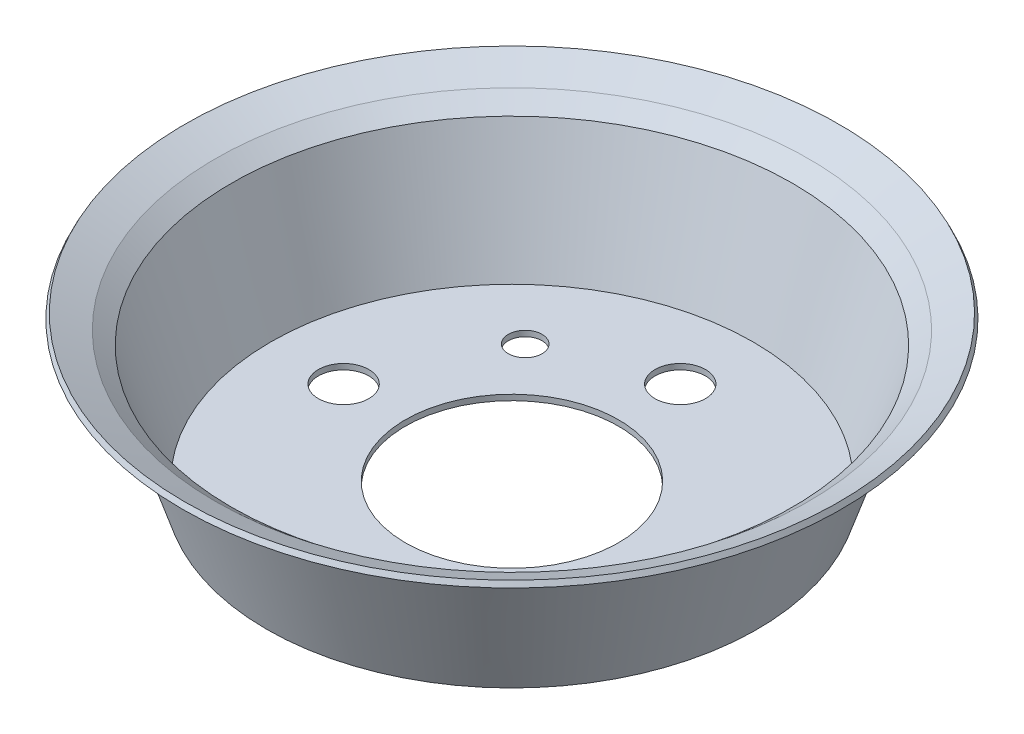
from build123d import *

# Parameters (mm, degrees)
SKETCH_2_R          = 4.5
CUT_EXTRUDE_1_DEPTH = 40
SKETCH_3_R          = 3
CUT_EXTRUDE_2_DEPTH = 5


with BuildPart() as part:
    # Эскиз1 → Повернуть-Тонкостенный1 (revolve)
    with BuildSketch(Plane.XY, mode=Mode.PRIVATE) as revolve_1_sk:
        Polygon((19, 0), (43, 0), (50, 21), (52.889577147, 23.332201276), (58.302767501, 25.953006302), (58.738533119, 25.052946123), (53.42847461, 22.482072549), (50.856038751, 20.405838593), (43.72075922, -1), (19, -1), align=None)
    revolve(revolve_1_sk.sketch.rotate(Axis((0, 0, 0), (0, -1, 0)), 90), axis=Axis((0, 0, 0), (0, -1, 0)))

    # Эскиз2 → Вытянуть1 (cut, symmetric)
    with BuildSketch(Plane(origin=(0, 0, 0), x_dir=(1, 0, 0), z_dir=(0, 1, 0))):
        with Locations(Location((30, 0, 0), (0, 0, 270))):
            Circle(SKETCH_2_R)
        with Locations(Location((-30, 0, 0), (0, 0, 270))):
            Circle(SKETCH_2_R)
        with Locations(Location((0, 30, 0), (0, 0, 270))):
            Circle(SKETCH_2_R)
        with Locations(Location((0, -30, 0), (0, 0, 270))):
            Circle(SKETCH_2_R)
    extrude(amount=CUT_EXTRUDE_1_DEPTH, both=True, mode=Mode.SUBTRACT)

    # Эскиз3 → Вытянуть2 (cut, symmetric)
    with BuildSketch(Plane(origin=(0, 0, 0), x_dir=(1, 0, 0), z_dir=(0, 1, 0))):
        with Locations(Location((20, -22.360679775, 0), (0, 0, 270))):
            Circle(SKETCH_3_R)
        with Locations(Location((-20, 22.360679775, 0), (0, 0, 270))):
            Circle(SKETCH_3_R)
    extrude(amount=CUT_EXTRUDE_2_DEPTH, both=True, mode=Mode.SUBTRACT)


solid = part.part
